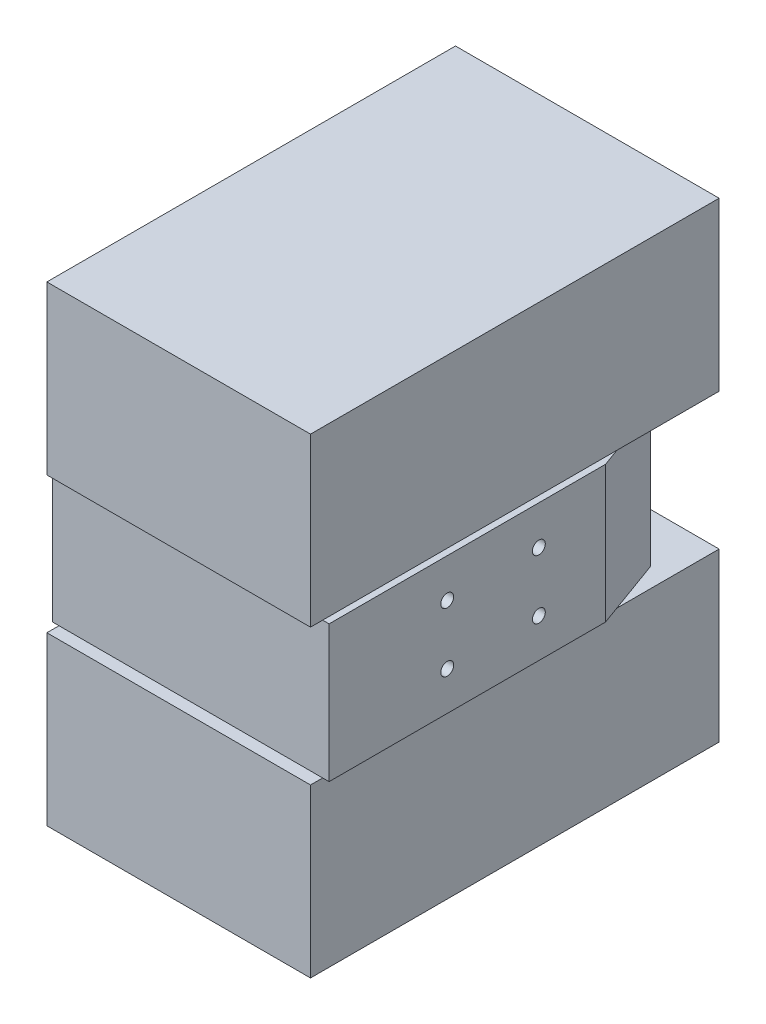
from build123d import *

# Parameters (mm, degrees)
BOSS_EXTRUDE1_DEPTH      = 21.25
BOSS_EXTRUDE1_DEPTH_BACK = 21.25
SKETCH2_R                = 2
CUT_EXTRUDE1_DEPTH       = 140.683794694
SKETCH3_W                = 82
SKETCH3_H                = 127.094201992
BOSS_EXTRUDE2_DEPTH      = 52


with BuildPart() as part:
    # Sketch1 → Boss-Extrude1 (new, two sides: drawn at the far end of the back side and taken through both)
    with BuildSketch(Plane(origin=(0, 0, 0), x_dir=(1, 0, 0), z_dir=(0, 1, 0)).offset(-BOSS_EXTRUDE1_DEPTH_BACK)):
        Polygon((-43, -22), (-35, 0), (35, 0), (43, -22), (43, -108), (-43, -108), align=None)
    extrude(amount=BOSS_EXTRUDE1_DEPTH + BOSS_EXTRUDE1_DEPTH_BACK)

    # Sketch2 → Cut-Extrude1 (cut, through all)
    with BuildSketch(Plane(origin=(43, 0, 0), x_dir=(0, 0, -1), z_dir=(1, 0, 0))):
        with Locations((-71.25, 9.2)):
            Circle(SKETCH2_R)
        with Locations((-42.75, 9.2)):
            Circle(SKETCH2_R)
        with Locations((-42.75, -9.2)):
            Circle(SKETCH2_R)
        with Locations((-71.25, -9.2)):
            Circle(SKETCH2_R)
    extrude(amount=-CUT_EXTRUDE1_DEPTH, mode=Mode.SUBTRACT)

    # Sketch3 → Boss-Extrude2 (add)
    with BuildSketch(Plane(origin=(0, 21.25, 0), x_dir=(1, 0, 0), z_dir=(0, 1, 0))):
        with Locations((0, -48.227100996)):
            Rectangle(SKETCH3_W, SKETCH3_H)
    boss_extrude2 = extrude(amount=BOSS_EXTRUDE2_DEPTH)

    # Mirror1: Boss-Extrude2 across plane
    add(boss_extrude2.mirror(Plane.ZX))


solid = part.part
